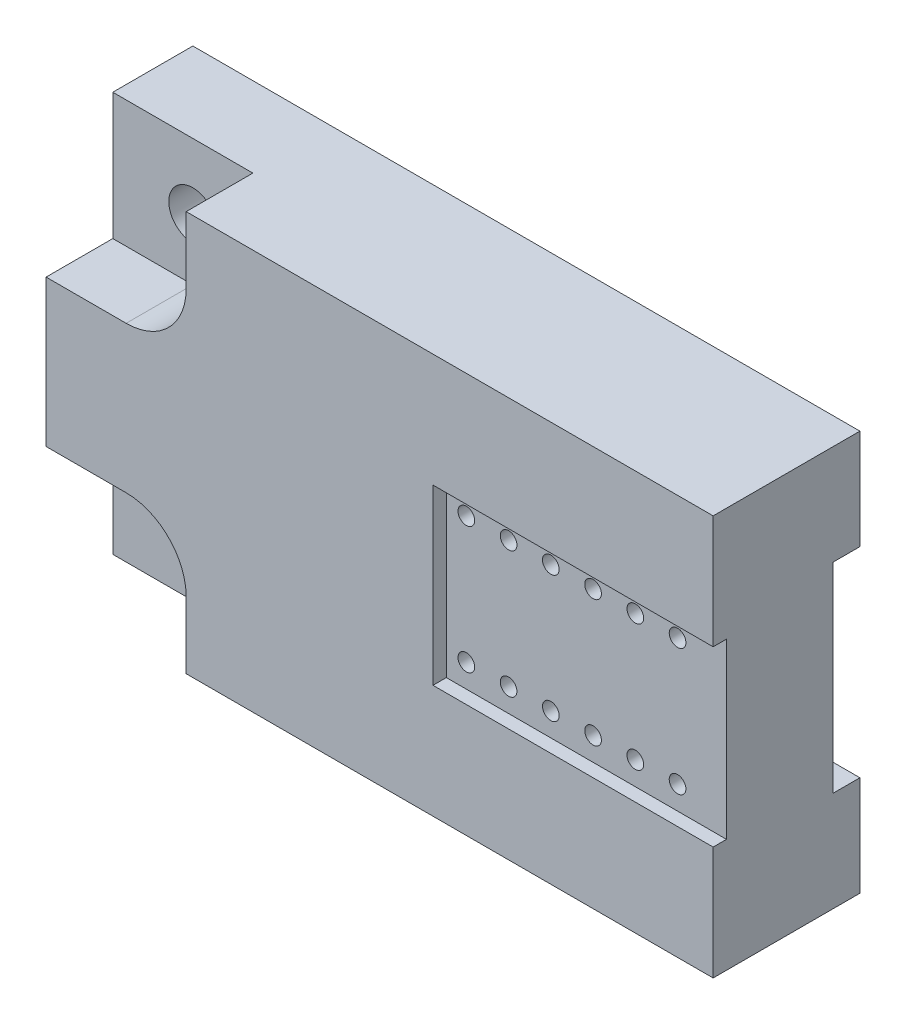
from build123d import *

# Parameters (mm, degrees)
SKIZZE1_W                       = 100
SKIZZE1_H                       = 60
AUFSATZ_LINEAR_AUSTRAGEN1_DEPTH = 12
SKIZZE3_R                       = 3.6
SCHNITT_LINEAR_AUSTRAGEN2_DEPTH = 20
AUFSATZ_LINEAR_AUSTRAGEN2_DEPTH = 10
SKIZZE9_W                       = 42
SKIZZE9_H                       = 26
SCHNITT_LINEAR_AUSTRAGEN6_DEPTH = 2
SKIZZE10_W                      = 44
SKIZZE10_H                      = 30
SCHNITT_LINEAR_AUSTRAGEN7_DEPTH = 4
SKIZZE11_R                      = 1.25
SCHNITT_LINEAR_AUSTRAGEN8_DEPTH = 119.321595662


with BuildPart() as part:
    # Skizze1 → Aufsatz-Linear austragen1 (new body)
    with BuildSketch(Plane.XY):
        with Locations((-50, -30)):
            Rectangle(SKIZZE1_W, SKIZZE1_H)
    extrude(amount=AUFSATZ_LINEAR_AUSTRAGEN1_DEPTH)

    # Skizze3 → Schnitt-Linear austragen2 (cut)
    with BuildSketch(Plane.XY.offset(12)):
        with Locations((-88, -10)):
            Circle(SKIZZE3_R)
        with Locations((-88, -50)):
            Circle(SKIZZE3_R)
    extrude(amount=-SCHNITT_LINEAR_AUSTRAGEN2_DEPTH, mode=Mode.SUBTRACT)

    # Skizze5 → Aufsatz-Linear austragen2 (add)
    with BuildSketch(Plane.XY.offset(12)):
        with BuildLine():
            Line((-100, -41), (-88, -41))
            ThreePointArc((-88, -41), (-81.636038969, -43.636038969), (-79, -50))
            Line((-79, -50), (-79, -60))
            Line((-79, -60), (0, -60))
            Line((0, -60), (0, 0))
            Line((0, 0), (-79, 0))
            Line((-79, 0), (-79, -10))
            ThreePointArc((-79, -10), (-81.636038969, -16.363961031), (-88, -19))
            Line((-88, -19), (-100, -19))
            Line((-100, -19), (-100, -41))
        make_face()
    extrude(amount=AUFSATZ_LINEAR_AUSTRAGEN2_DEPTH)

    # Skizze9 → Schnitt-Linear austragen6 (cut)
    with BuildSketch(Plane.XY.offset(22)):
        with Locations((-21, -30)):
            Rectangle(SKIZZE9_W, SKIZZE9_H)
    extrude(amount=-SCHNITT_LINEAR_AUSTRAGEN6_DEPTH, mode=Mode.SUBTRACT)

    # Skizze10 → Schnitt-Linear austragen7 (cut)
    with BuildSketch(Plane(origin=(0, 0, 0), x_dir=(-1, 0, 0), z_dir=(0, 0, -1))):
        with Locations((22, -30)):
            Rectangle(SKIZZE10_W, SKIZZE10_H)
    extrude(amount=-SCHNITT_LINEAR_AUSTRAGEN7_DEPTH, mode=Mode.SUBTRACT)

    # Skizze11 → Schnitt-Linear austragen8 (cut, through all)
    with BuildSketch(Plane.XY.offset(20)):
        with Locations((-39, -20.5)):
            Circle(SKIZZE11_R)
        with Locations((-39, -39.5)):
            Circle(SKIZZE11_R)
        with Locations((-32.667, -20.5)):
            Circle(SKIZZE11_R)
        with Locations((-32.667, -39.5)):
            Circle(SKIZZE11_R)
        with Locations((-26.334, -20.5)):
            Circle(SKIZZE11_R)
        with Locations((-26.334, -39.5)):
            Circle(SKIZZE11_R)
        with Locations((-20.001, -20.5)):
            Circle(SKIZZE11_R)
        with Locations((-20.001, -39.5)):
            Circle(SKIZZE11_R)
        with Locations((-13.668, -20.5)):
            Circle(SKIZZE11_R)
        with Locations((-13.668, -39.5)):
            Circle(SKIZZE11_R)
        with Locations((-7.335, -20.5)):
            Circle(SKIZZE11_R)
        with Locations((-7.335, -39.5)):
            Circle(SKIZZE11_R)
    extrude(amount=-SCHNITT_LINEAR_AUSTRAGEN8_DEPTH, mode=Mode.SUBTRACT)


solid = part.part
